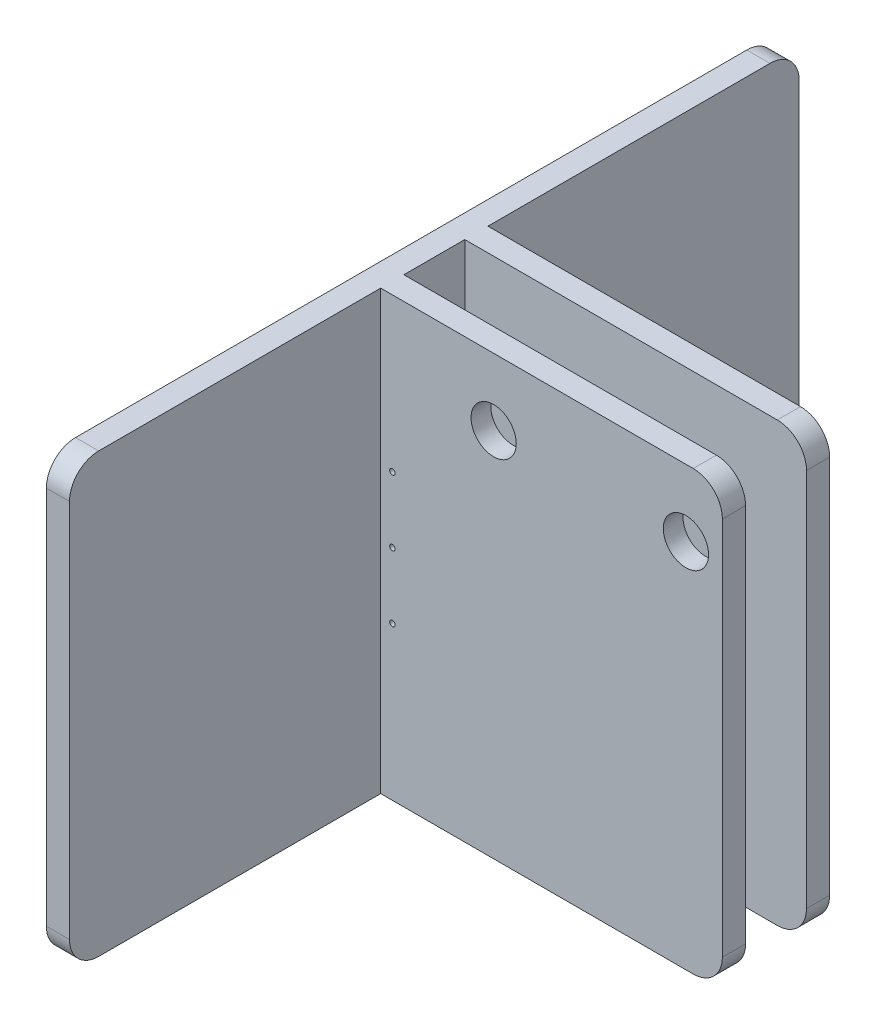
from build123d import *

# Parameters (mm, degrees)
BOSS_EXTRUDE1_DEPTH = 60
SKETCH3_R           = 3.1
CUT_EXTRUDE1_DEPTH  = 2.7
CUT_EXTRUDE2_START  = -2.7
SKETCH4_R           = 3.1
CUT_EXTRUDE2_DEPTH  = 2.7
FILLET1_R           = 4
CUT_EXTRUDE3_REACH  = 81.474
SKETCH5_R           = 0.375
SKETCH6_W           = 3.175
SKETCH6_H           = 60
BOSS_EXTRUDE2_DEPTH = 42.65
SKETCH7_W           = 3.175
SKETCH7_H           = 60
BOSS_EXTRUDE3_DEPTH = 42.65
FILLET2_R           = 4


with BuildPart() as part:
    # Sketch1 → Boss-Extrude1 (new body)
    with BuildSketch(Plane(origin=(0, 0, 0), x_dir=(1, 0, 0), z_dir=(0, 1, 0))):
        Polygon((0, 7.35), (0, -7.35), (50, -7.35), (50, -4.175), (3.175, -4.175), (3.175, 4.175), (50, 4.175), (50, 7.35), align=None)
    extrude(amount=BOSS_EXTRUDE1_DEPTH)

    # Sketch3 → Cut-Extrude1 (cut)
    with BuildSketch(Plane.XY.offset(7.35)):
        with Locations((45, 50.82)):
            Circle(SKETCH3_R)
        with Locations((18.65, 50.82)):
            Circle(SKETCH3_R)
    extrude(amount=-CUT_EXTRUDE1_DEPTH, mode=Mode.SUBTRACT)

    # Sketch4 → Cut-Extrude2 (cut)
    with BuildSketch(Plane(origin=(0, 0, -7.35), x_dir=(-1, 0, 0), z_dir=(0, 0, -1)).offset(CUT_EXTRUDE2_START)):
        with Locations(Location((-45, 50.82, 0), (0, 0, 180))):
            Circle(SKETCH4_R)
        with Locations(Location((-18.65, 50.82, 0), (0, 0, 180))):
            Circle(SKETCH4_R)
    extrude(amount=CUT_EXTRUDE2_DEPTH, mode=Mode.SUBTRACT)

    # Fillet1
    fillet1_edges = [part.edges().sort_by_distance(p)[0] for p in [
        (50, 0, 5.7625),
        (50, 60, -5.7625),
        (50, 60, 5.7625),
        (50, 0, -5.7625),
    ]]
    fillet(fillet1_edges, radius=FILLET1_R)

    # Cut-Extrude3: up to this face of the body (flat: up to its plane)
    cut_extrude3_end = Plane(part.part.faces().sort_by_distance((24.80303516, 29.571344164, -7.35))[0])
    # Sketch5 → Cut-Extrude3 (cut, up to the picked face)
    with BuildSketch(Plane.XY.offset(7.35), mode=Mode.PRIVATE) as cut_extrude3_sk1:
        with Locations((4.779169586, 21)):
            Circle(SKETCH5_R)
    cut_extrude3_tool1 = split(extrude(cut_extrude3_sk1.sketch, amount=-CUT_EXTRUDE3_REACH, mode=Mode.PRIVATE), bisect_by=cut_extrude3_end, keep=Keep.BOTH, mode=Mode.PRIVATE)
    # Sketch5 → Cut-Extrude3 (cut, up to the picked face)
    with BuildSketch(Plane.XY.offset(7.35), mode=Mode.PRIVATE) as cut_extrude3_sk2:
        with Locations((4.779169586, 39)):
            Circle(SKETCH5_R)
    cut_extrude3_tool2 = split(extrude(cut_extrude3_sk2.sketch, amount=-CUT_EXTRUDE3_REACH, mode=Mode.PRIVATE), bisect_by=cut_extrude3_end, keep=Keep.BOTH, mode=Mode.PRIVATE)
    # Sketch5 → Cut-Extrude3 (cut, up to the picked face)
    with BuildSketch(Plane.XY.offset(7.35), mode=Mode.PRIVATE) as cut_extrude3_sk3:
        with Locations((4.779169586, 30)):
            Circle(SKETCH5_R)
    cut_extrude3_tool3 = split(extrude(cut_extrude3_sk3.sketch, amount=-CUT_EXTRUDE3_REACH, mode=Mode.PRIVATE), bisect_by=cut_extrude3_end, keep=Keep.BOTH, mode=Mode.PRIVATE)
    add(cut_extrude3_tool1.solids().sort_by(Axis((4.77917, 21, 7.35), (0, 0, -1)))[0], mode=Mode.SUBTRACT)
    add(cut_extrude3_tool2.solids().sort_by(Axis((4.77917, 39, 7.35), (0, 0, -1)))[0], mode=Mode.SUBTRACT)
    add(cut_extrude3_tool3.solids().sort_by(Axis((4.77917, 30, 7.35), (0, 0, -1)))[0], mode=Mode.SUBTRACT)

    # Sketch6 → Boss-Extrude2 (add)
    with BuildSketch(Plane.XY.offset(7.35)):
        with Locations((1.5875, 30)):
            Rectangle(SKETCH6_W, SKETCH6_H)
    extrude(amount=BOSS_EXTRUDE2_DEPTH)

    # Sketch7 → Boss-Extrude3 (add)
    with BuildSketch(Plane(origin=(0, 0, -7.35), x_dir=(-1, 0, 0), z_dir=(0, 0, -1))):
        with Locations((-1.5875, 30)):
            Rectangle(SKETCH7_W, SKETCH7_H)
    extrude(amount=BOSS_EXTRUDE3_DEPTH)

    # Fillet2
    fillet2_edges = [part.edges().sort_by_distance(p)[0] for p in [
        (1.5875, 60, -50),
        (1.5875, 0, -50),
        (1.5875, 0, 50),
        (1.5875, 60, 50),
    ]]
    fillet(fillet2_edges, radius=FILLET2_R)


solid = part.part
